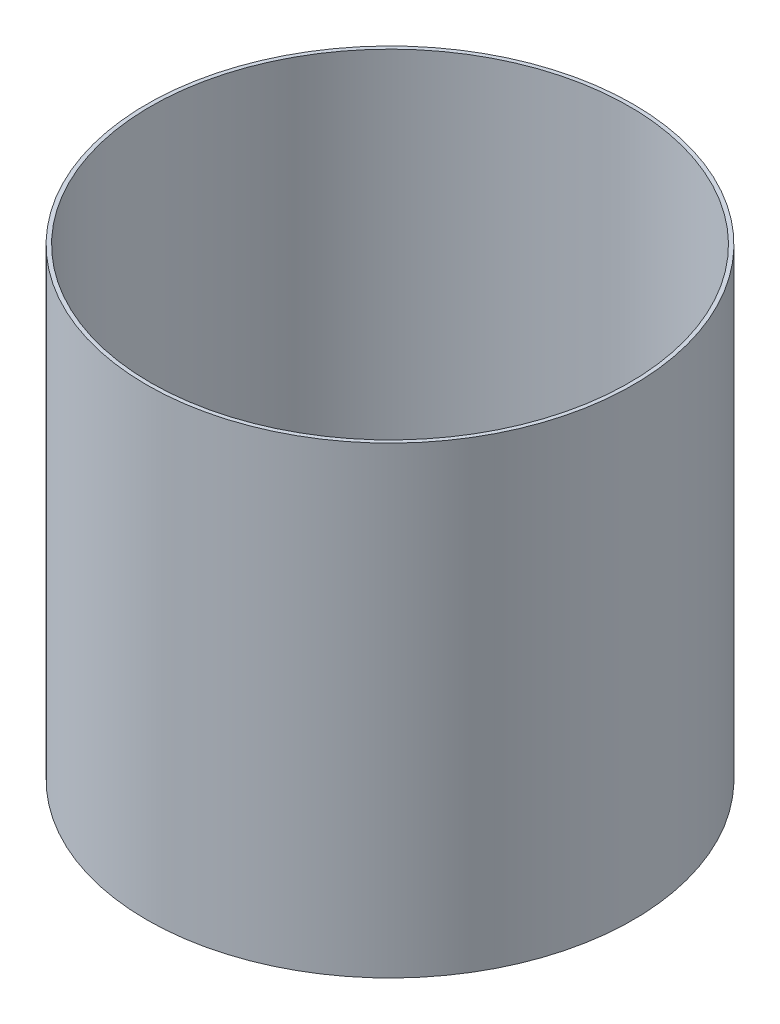
from build123d import *

# Parameters (mm, degrees)
SKETCH1_R           = 63
BOSS_EXTRUDE1_DEPTH = 120
SHELL1_T            = -1


with BuildPart() as part:
    # Sketch1 → Boss-Extrude1 (new body)
    with BuildSketch(Plane(origin=(0, 0, 0), x_dir=(1, 0, 0), z_dir=(0, 1, 0))):
        with Locations(Location((0, 0, 0), (0, 0, 270))):
            Circle(SKETCH1_R)
    extrude(amount=BOSS_EXTRUDE1_DEPTH)

    # Shell1
    shell1_openings = [part.faces().sort_by_distance(p)[0] for p in [
        (0, 120, 0),
    ]]
    offset(amount=SHELL1_T, openings=shell1_openings, kind=Kind.INTERSECTION)


solid = part.part
